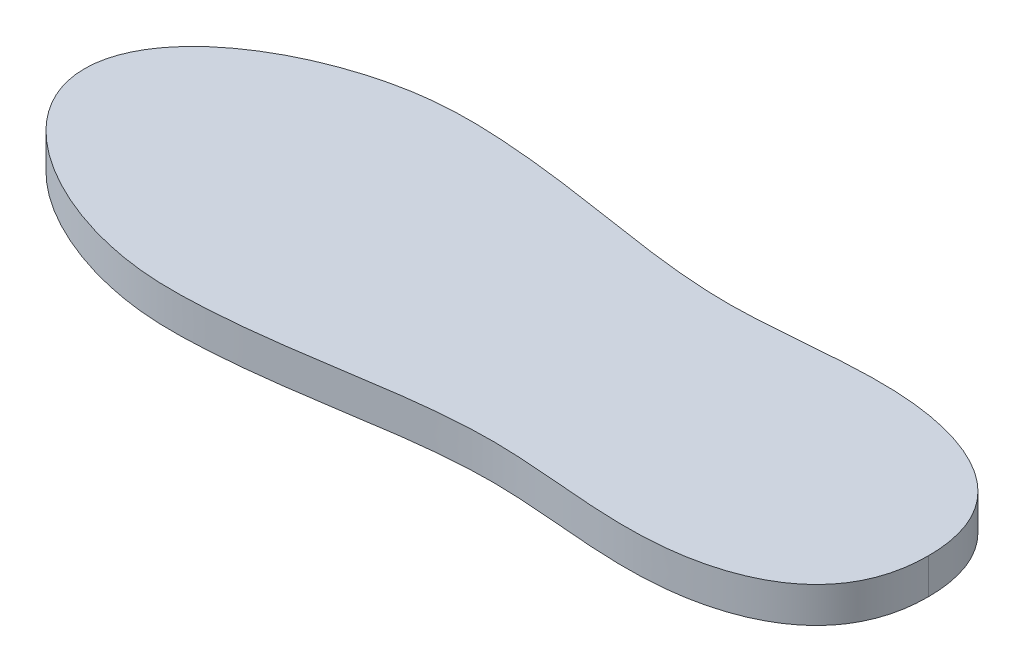
from build123d import *

# Parameters (mm, degrees)
BOSS_EXTRUDE1_DEPTH = 12


with BuildPart() as part:
    # Sketch1 → Boss-Extrude1 (new body)
    with BuildSketch(Plane(origin=(0, 0, 0), x_dir=(1, 0, 0), z_dir=(0, 1, 0))):
        with BuildLine():
            add(Edge.make_bspline(
                [(-250, 0), (-250, 25.544299451), (-206.068982537, 51.030043951), (-130.972520019, 49.21590466), (-78.73154972, 33.359145099), (-5.009154927, 49.904567739), (35, 24.748385361), (35, 0)],
                knots=[0, 0, 0, 0, 0.267008453, 0.328280505, 0.612720521, 0.832853717, 1, 1, 1, 1], degree=3))
            add(Edge.make_bspline(
                [(-250, 0), (-250, -25.544299451), (-206.068982537, -51.030043951), (-130.972520019, -49.21590466), (-78.73154972, -33.359145099), (-5.009154927, -49.904567739), (35, -24.748385361), (35, 0)],
                knots=[0, 0, 0, 0, 0.267008453, 0.328280505, 0.612720521, 0.832853717, 1, 1, 1, 1], degree=3))
        make_face()
    extrude(amount=BOSS_EXTRUDE1_DEPTH)


solid = part.part
